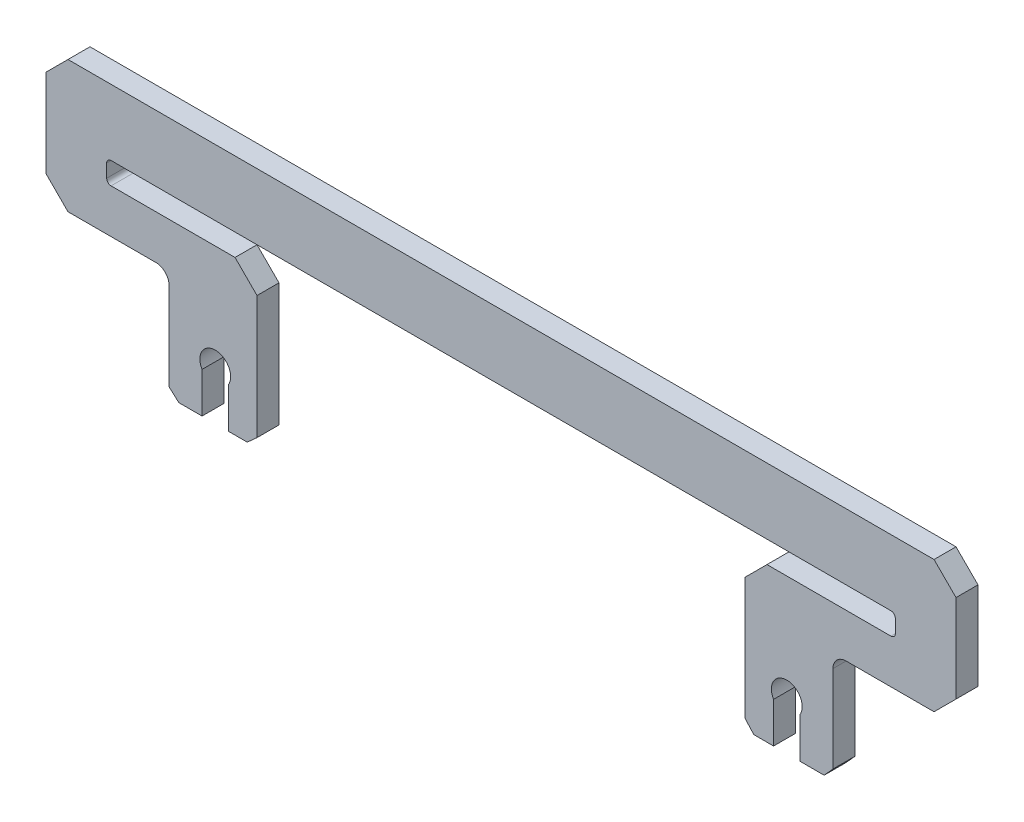
from build123d import *
from OCP.BRepFilletAPI import BRepFilletAPI_MakeChamfer

# Parameters (mm, degrees)
SKETCH_1_W           = 177
SKETCH_1_H           = 15
EXTRUDE_1_DEPTH      = 5
SKETCH_3_W           = 15
SKETCH_3_H           = 55
EXTRUDE_3_DEPTH      = 5
SKETCH_9_W           = 33
SKETCH_9_H           = 35
EXTRUDE_5_DEPTH      = 5
CUT_EXTRUDE_4_REACH  = 115.989
CUT_EXTRUDE_5_REACH  = 115.989
SKETCH_10_R          = 3
SKETCH_13_W          = 28
SKETCH_13_H          = 25
CUT_EXTRUDE_8_DEPTH  = 10
CHAMFER_4_SIZE       = 5
FILLET_3_R           = 3
SKETCH_14_W          = 6
SKETCH_14_H          = 11
CUT_EXTRUDE_9_DEPTH  = 10
SKETCH_15_R          = 3.5
CUT_EXTRUDE_10_DEPTH = 10
CHAMFER_5_SIZE       = 2
CHAMFER_5_SIZE2      = 2.22122503


with BuildPart() as part:
    # 스케치1 → 보스-돌출1 (new body)
    with BuildSketch(Plane.XY):
        Rectangle(SKETCH_1_W, SKETCH_1_H)
    extrude(amount=EXTRUDE_1_DEPTH)

    # 스케치3 → 보스-돌출3 (add)
    with BuildSketch(Plane.XY.offset(5)):
        with Locations((96, -20)):
            Rectangle(SKETCH_3_W, SKETCH_3_H)
        with Locations((-96, -20)):
            Rectangle(SKETCH_3_W, SKETCH_3_H)
    extrude(amount=-EXTRUDE_3_DEPTH)

    # 스케치9 → 보스-돌출5 (add)
    with BuildSketch(Plane.XY.offset(5)):
        with Locations((-72, -30)):
            Rectangle(SKETCH_9_W, SKETCH_9_H)
        with Locations((72, -30)):
            Rectangle(SKETCH_9_W, SKETCH_9_H)
    extrude(amount=-EXTRUDE_5_DEPTH)

    # 스케치8 → 컷-돌출4 (cut, up to next)
    with BuildSketch(Plane.XY.offset(5), mode=Mode.PRIVATE) as cut_extrude_4_sk1:
        with BuildLine():
            Line((-88.5, -7.5), (-88.7, -7.5))
            ThreePointArc((-88.7, -7.5), (-89.407106781, -7.792893219), (-89.7, -8.5))
            Line((-89.7, -8.5), (-89.7, -11.5))
            ThreePointArc((-89.7, -11.5), (-89.407106781, -12.207106781), (-88.7, -12.5))
            Line((-88.7, -12.5), (-88.5, -12.5))
            Line((-88.5, -12.5), (-88.5, -7.5))
        make_face()
    cut_extrude_4_tool1 = extrude(cut_extrude_4_sk1.sketch, amount=-CUT_EXTRUDE_4_REACH, mode=Mode.PRIVATE) & part.part
    # 스케치8 → 컷-돌출4 (cut, up to next)
    with BuildSketch(Plane.XY.offset(5), mode=Mode.PRIVATE) as cut_extrude_4_sk2:
        with BuildLine():
            Line((88.5, -7.5), (88.7, -7.5))
            ThreePointArc((88.7, -7.5), (89.407106781, -7.792893219), (89.7, -8.5))
            Line((89.7, -8.5), (89.7, -11.5))
            ThreePointArc((89.7, -11.5), (89.407106781, -12.207106781), (88.7, -12.5))
            Line((88.7, -12.5), (88.5, -12.5))
            Line((88.5, -12.5), (88.5, -7.5))
        make_face()
    cut_extrude_4_tool2 = extrude(cut_extrude_4_sk2.sketch, amount=-CUT_EXTRUDE_4_REACH, mode=Mode.PRIVATE) & part.part
    add(cut_extrude_4_tool1.solids().sort_by_distance((-89.070982, -10, 5))[0], mode=Mode.SUBTRACT)
    add(cut_extrude_4_tool2.solids().sort_by_distance((89.070982, -10, 5))[0], mode=Mode.SUBTRACT)

    # 스케치10 → 컷-돌출5 (cut, up to next)
    with BuildSketch(Plane.XY.offset(5), mode=Mode.PRIVATE) as cut_extrude_5_sk1:
        with Locations((65, -36.5)):
            Circle(SKETCH_10_R)
    cut_extrude_5_tool1 = extrude(cut_extrude_5_sk1.sketch, amount=-CUT_EXTRUDE_5_REACH, mode=Mode.PRIVATE) & part.part
    # 스케치10 → 컷-돌출5 (cut, up to next)
    with BuildSketch(Plane.XY.offset(5), mode=Mode.PRIVATE) as cut_extrude_5_sk2:
        with Locations((-65, -36.5)):
            Circle(SKETCH_10_R)
    cut_extrude_5_tool2 = extrude(cut_extrude_5_sk2.sketch, amount=-CUT_EXTRUDE_5_REACH, mode=Mode.PRIVATE) & part.part
    add(cut_extrude_5_tool1.solids().sort_by_distance((65, -36.5, 5))[0], mode=Mode.SUBTRACT)
    add(cut_extrude_5_tool2.solids().sort_by_distance((-65, -36.5, 5))[0], mode=Mode.SUBTRACT)

    # 스케치13 → 컷-돌출8 (cut)
    with BuildSketch(Plane(origin=(0, 0, 0), x_dir=(-1, 0, 0), z_dir=(0, 0, -1))):
        with Locations((-89.5, -35)):
            Rectangle(SKETCH_13_W, SKETCH_13_H)
        with Locations((89.5, -35)):
            Rectangle(SKETCH_13_W, SKETCH_13_H)
    extrude(amount=-CUT_EXTRUDE_8_DEPTH, mode=Mode.SUBTRACT)

    # 모따기4
    chamfer_4_edges = [part.edges().sort_by_distance(p)[0] for p in [
        (103.5, -22.5, 2.5),
        (-103.5, -22.5, 2.5),
        (103.5, 7.5, 2.5),
        (-103.5, 7.5, 2.5),
        (-55.5, -12.5, 2.5),
        (55.5, -12.5, 2.5),
    ]]
    chamfer(chamfer_4_edges, length=CHAMFER_4_SIZE)

    # 필렛3
    fillet_3_edges = [part.edges().sort_by_distance(p)[0] for p in [
        (75.5, -22.5, 2.5),
        (-75.5, -22.5, 2.5),
    ]]
    fillet(fillet_3_edges, radius=FILLET_3_R)

    # 스케치14 → 컷-돌출9 (cut)
    with BuildSketch(Plane(origin=(0, 0, 0), x_dir=(-1, 0, 0), z_dir=(0, 0, -1))):
        with Locations((-65, -42)):
            Rectangle(SKETCH_14_W, SKETCH_14_H)
        with Locations((65, -42)):
            Rectangle(SKETCH_14_W, SKETCH_14_H)
    extrude(amount=-CUT_EXTRUDE_9_DEPTH, mode=Mode.SUBTRACT)

    # 스케치15 → 컷-돌출10 (cut)
    with BuildSketch(Plane(origin=(0, 0, 0), x_dir=(-1, 0, 0), z_dir=(0, 0, -1))):
        with Locations((65, -36.5)):
            Circle(SKETCH_15_R)
        with Locations((-65, -36.5)):
            Circle(SKETCH_15_R)
    extrude(amount=-CUT_EXTRUDE_10_DEPTH, mode=Mode.SUBTRACT)

    # 모따기5: one chamfer whose edges measure the first distance from different faces: ONE call of the kernel's chamfer builder (chamfer() names one face for all edges)
    chamfer_5_edges_1 = [part.edges().sort_by_distance(p)[0] for p in [
        (75.5, -47.5, 2.5),
    ]]
    chamfer_5_side_1 = [part.faces().sort_by_distance(p)[0] for p in [
        (71.75, -47.5, 2.5),
    ]]
    chamfer_5_edges_2 = [part.edges().sort_by_distance(p)[0] for p in [
        (-75.5, -47.5, 2.5),
    ]]
    chamfer_5_side_2 = [part.faces().sort_by_distance(p)[0] for p in [
        (-75.5, -36.5, 2.5),
    ]]
    chamfer_5_edges_3 = [part.edges().sort_by_distance(p)[0] for p in [
        (-55.5, -47.5, 2.5),
    ]]
    chamfer_5_side_3 = [part.faces().sort_by_distance(p)[0] for p in [
        (-55.5, -32.5, 2.5),
    ]]
    chamfer_5_edges_4 = [part.edges().sort_by_distance(p)[0] for p in [
        (55.5, -47.5, 2.5),
    ]]
    chamfer_5_side_4 = [part.faces().sort_by_distance(p)[0] for p in [
        (58.75, -47.5, 2.5),
    ]]
    chamfer_5 = BRepFilletAPI_MakeChamfer(part.part.solid().wrapped)
    for e in chamfer_5_edges_1:
        chamfer_5.Add(CHAMFER_5_SIZE, CHAMFER_5_SIZE2, e.wrapped, chamfer_5_side_1[0].wrapped)  # the first distance lies on this face
    for e in chamfer_5_edges_2:
        chamfer_5.Add(CHAMFER_5_SIZE, CHAMFER_5_SIZE2, e.wrapped, chamfer_5_side_2[0].wrapped)  # the first distance lies on this face
    for e in chamfer_5_edges_3:
        chamfer_5.Add(CHAMFER_5_SIZE, CHAMFER_5_SIZE2, e.wrapped, chamfer_5_side_3[0].wrapped)  # the first distance lies on this face
    for e in chamfer_5_edges_4:
        chamfer_5.Add(CHAMFER_5_SIZE, CHAMFER_5_SIZE2, e.wrapped, chamfer_5_side_4[0].wrapped)  # the first distance lies on this face
    add(Compound.cast(chamfer_5.Shape()), mode=Mode.REPLACE)


solid = part.part
